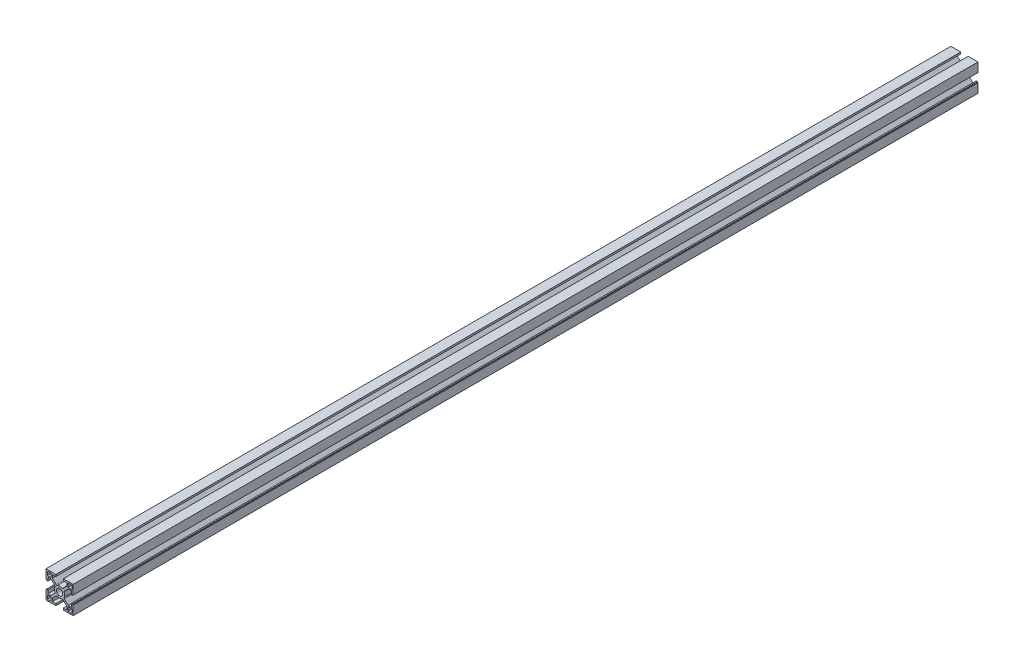
from build123d import *

# Parameters (mm, degrees)
SKETCH1_R           = 3.5
SKETCH1_W           = 4.25
SKETCH1_H           = 4.25
BOSS_EXTRUDE1_DEPTH = 500


with BuildPart() as part:
    # Sketch1 → Boss-Extrude1 (new, symmetric)
    with BuildSketch(Plane.XY):
        with BuildLine():
            Line((-13, 8), (-9.555634919, 8))
            Line((-9.555634919, 8), (-5.276706211, 3.721071292))
            ThreePointArc((-5.276706211, 3.721071292), (-4.996490762, 3.172693256), (-5.090706575, 2.564119062))
            ThreePointArc((-5.090706575, 2.564119062), (-5.688941006, -0.354894676), (-4.732561446, -3.176926527))
            Line((-4.732561446, -3.176926527), (-9.555634919, -8))
            Line((-9.555634919, -8), (-13, -8))
            Line((-13, -8), (-13, -4.1))
            Line((-13, -4.1), (-14.3, -4.1))
            Line((-14.3, -4.1), (-14.3, -4.8))
            Line((-14.3, -4.8), (-15, -4.8))
            Line((-15, -4.8), (-15, -15))
            Line((-15, -15), (-4.1, -15))
            Line((-4.1, -15), (-4.1, -13))
            Line((-4.1, -13), (-8, -13))
            Line((-8, -13), (-8, -9.555634919))
            Line((-8, -9.555634919), (-3.721071292, -5.276706211))
            ThreePointArc((-3.721071292, -5.276706211), (-3.172693256, -4.996490762), (-2.564119062, -5.090706575))
            ThreePointArc((-2.564119062, -5.090706575), (0, -5.7), (2.564119062, -5.090706575))
            ThreePointArc((2.564119062, -5.090706575), (3.172693256, -4.996490762), (3.721071292, -5.276706211))
            Line((3.721071292, -5.276706211), (8, -9.555634919))
            Line((8, -9.555634919), (8, -13))
            Line((8, -13), (4.1, -13))
            Line((4.1, -13), (4.1, -15))
            Line((4.1, -15), (15, -15))
            Line((15, -15), (15, -4.8))
            Line((15, -4.8), (14.3, -4.8))
            Line((14.3, -4.8), (14.3, -4.1))
            Line((14.3, -4.1), (13, -4.1))
            Line((13, -4.1), (13, -8))
            Line((13, -8), (9.555634919, -8))
            Line((9.555634919, -8), (5.276706211, -3.721071292))
            ThreePointArc((5.276706211, -3.721071292), (4.996490762, -3.172693256), (5.090706575, -2.564119062))
            ThreePointArc((5.090706575, -2.564119062), (5.7, 0), (5.090706575, 2.564119062))
            ThreePointArc((5.090706575, 2.564119062), (4.996490762, 3.172693256), (5.276706211, 3.721071292))
            Line((5.276706211, 3.721071292), (9.555634919, 8))
            Line((9.555634919, 8), (13, 8))
            Line((13, 8), (13, 4.1))
            Line((13, 4.1), (14.3, 4.1))
            Line((14.3, 4.1), (14.3, 4.8))
            Line((14.3, 4.8), (15, 4.8))
            Line((15, 4.8), (15, 15))
            Line((15, 15), (4.1, 15))
            Line((4.1, 15), (4.1, 13))
            Line((4.1, 13), (8, 13))
            Line((8, 13), (8, 9.555634919))
            Line((8, 9.555634919), (3.721071292, 5.276706211))
            ThreePointArc((3.721071292, 5.276706211), (3.172693256, 4.996490762), (2.564119062, 5.090706575))
            ThreePointArc((2.564119062, 5.090706575), (0, 5.7), (-2.564119062, 5.090706575))
            ThreePointArc((-2.564119062, 5.090706575), (-3.172693256, 4.996490762), (-3.721071292, 5.276706211))
            Line((-3.721071292, 5.276706211), (-8, 9.555634919))
            Line((-8, 9.555634919), (-8, 13))
            Line((-8, 13), (-4.1, 13))
            Line((-4.1, 13), (-4.1, 15))
            Line((-4.1, 15), (-15, 15))
            Line((-15, 15), (-15, 4.8))
            Line((-15, 4.8), (-14.3, 4.8))
            Line((-14.3, 4.8), (-14.3, 4.1))
            Line((-14.3, 4.1), (-13, 4.1))
            Line((-13, 4.1), (-13, 8))
        make_face()
        Circle(SKETCH1_R, mode=Mode.SUBTRACT)
        with Locations((11.375, 11.375)):
            Rectangle(SKETCH1_W, SKETCH1_H, mode=Mode.SUBTRACT)
        with Locations((-11.375, -11.375)):
            Rectangle(SKETCH1_W, SKETCH1_H, mode=Mode.SUBTRACT)
        with Locations((11.375, -11.375)):
            Rectangle(SKETCH1_W, SKETCH1_H, mode=Mode.SUBTRACT)
        with Locations((-11.375, 11.375)):
            Rectangle(SKETCH1_W, SKETCH1_H, mode=Mode.SUBTRACT)
    extrude(amount=BOSS_EXTRUDE1_DEPTH, both=True)


solid = part.part
